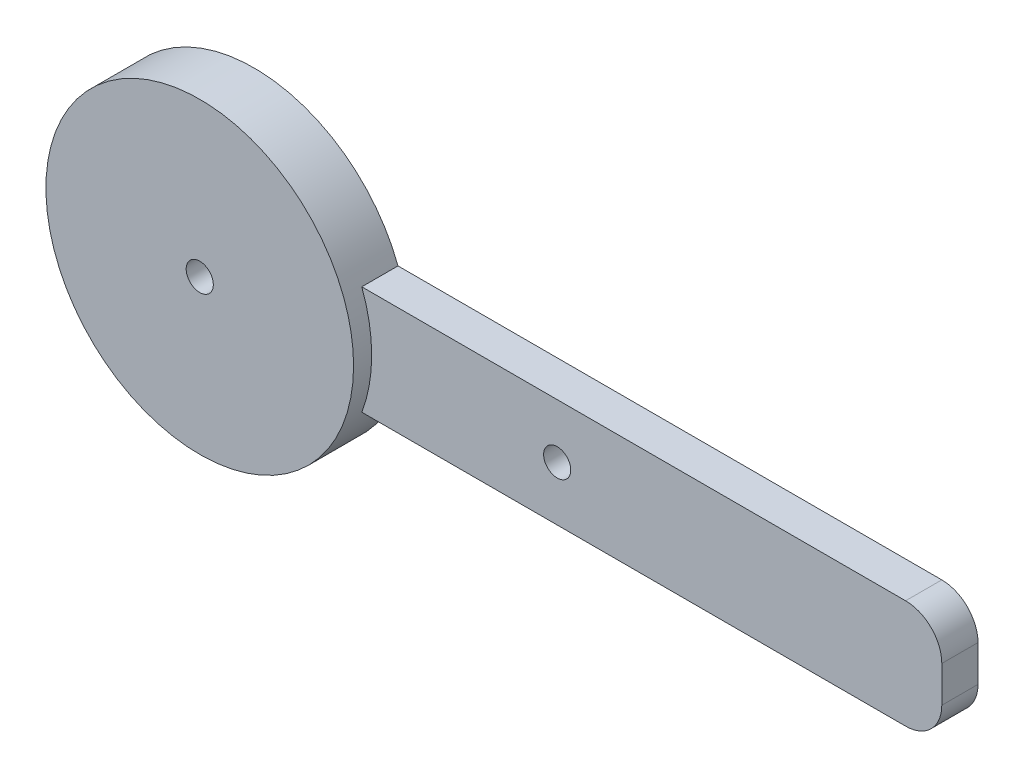
from build123d import *
from build123d.topology import SkipClean

# Parameters (mm, degrees)
SKETCH1_W                       = 80
SKETCH1_H                       = 12
BOSS_EXTRUDE1_DEPTH             = 2
CUT_REVOLVE1_ANGLE              = 180
FILLET2_R                       = 4
BOSS_EXTRUDE2_REACH             = 42.645
SKETCH6_R                       = 17
BOSS_EXTRUDE2_DIRECTION_2_DEPTH = 2
SKETCH7_R                       = 2.5
CUT_EXTRUDE3_DEPTH              = 3
CIRPATTERN1_COUNT               = 6
FILLET3_R                       = 1
CUT_EXTRUDE4_REACH              = 61.783
SKETCH8_R                       = 1.5
CUT_EXTRUDE5_REACH              = 61.783
SKETCH9_R                       = 1.5


with BuildPart() as part:
    # Sketch1 → Boss-Extrude1 (new, symmetric)
    with BuildSketch(Plane.XY):
        Rectangle(SKETCH1_W, SKETCH1_H)
    extrude(amount=BOSS_EXTRUDE1_DEPTH, both=True)

    # Sketch3 → Cut-Revolve1 (revolve, cut)
    with SkipClean():  # the faces are left unmerged after this step: merging them gives an invalid solid
        with BuildSketch(Plane.XY.offset(-2)):
            with BuildLine():
                ThreePointArc((37.75, 0), (35, 2.75), (32.25, 0))
                Line((32.25, 0), (37.75, 0))
            make_face()
            with BuildLine():
                Line((37.75, 0), (32.25, 0))
                ThreePointArc((32.25, 0), (35, -2.75), (37.75, 0))
            make_face()
        revolve(axis=Axis((32.25, 0, -2), (1, 0, 0)), revolution_arc=CUT_REVOLVE1_ANGLE, mode=Mode.SUBTRACT)

    # Fillet2
    fillet2_edges = [part.edges().sort_by_distance(p)[0] for p in [
        (40, -6, 0),
        (40, 6, 0),
    ]]
    fillet(fillet2_edges, radius=FILLET2_R)

    # Boss-Extrude2: up to this face of the body (flat: up to its plane)
    boss_extrude2_end = Plane(part.part.faces().sort_by_distance((-1.183693998, 0, -2))[0])
    # Sketch6 → Boss-Extrude2 (add, up to the picked face)
    with BuildSketch(Plane.XY.offset(2), mode=Mode.PRIVATE) as boss_extrude2_sk1:
        with Locations(Location((-40, 0, 0), (0, 0, 20.667316494))):
            Circle(SKETCH6_R)
    boss_extrude2_tool1 = split(extrude(boss_extrude2_sk1.sketch, amount=-BOSS_EXTRUDE2_REACH, mode=Mode.PRIVATE), bisect_by=boss_extrude2_end, keep=Keep.BOTH, mode=Mode.PRIVATE)
    add(boss_extrude2_tool1.solids().sort_by(Axis((-40, 0, 2), (0, 0, -1)))[0])

    # Sketch6 → Boss-Extrude2 direction 2 (add)
    with BuildSketch(Plane.XY.offset(2)):
        with Locations(Location((-40, 0, 0), (0, 0, 20.667316494))):
            Circle(SKETCH6_R)
    extrude(amount=BOSS_EXTRUDE2_DIRECTION_2_DEPTH)

    # Sketch7 → Cut-Extrude3 (cut)
    with BuildSketch(Plane(origin=(0, 0, -2), x_dir=(-1, 0, 0), z_dir=(0, 0, -1))):
        with BuildLine():
            Line((41.148365434, 4.169758006), (40, 4.325))
            ThreePointArc((40, 4.325), (35.675, 0), (40, -4.325))
            Line((40, -4.325), (41.148365434, -4.169758006))
            ThreePointArc((41.148365434, -4.169758006), (43.440371019, -2.620967808), (44.325, 0))
            ThreePointArc((44.325, 0), (43.440371019, 2.620967808), (41.148365434, 4.169758006))
        make_face()
        with BuildLine():
            Line((53.5, 2.5), (41.148365434, 4.169758006))
            ThreePointArc((41.148365434, 4.169758006), (43.440371019, 2.620967808), (44.325, 0))
            ThreePointArc((44.325, 0), (43.440371019, -2.620967808), (41.148365434, -4.169758006))
            Line((41.148365434, -4.169758006), (53.5, -2.5))
            ThreePointArc((53.5, -2.5), (51, 0), (53.5, 2.5))
        make_face()
        with Locations((53.5, 0)):
            Circle(SKETCH7_R)
    cut_extrude3 = extrude(amount=-CUT_EXTRUDE3_DEPTH, mode=Mode.SUBTRACT)

    # CirPattern1: Cut-Extrude3 ×6 about axis
    cirpattern1_axis = Axis((-40, 0, 0), (0, 0, 1))
    for i in range(1, CIRPATTERN1_COUNT):
        add(cut_extrude3.rotate(cirpattern1_axis, i * 360 / CIRPATTERN1_COUNT), mode=Mode.SUBTRACT)

    # Fillet3
    fillet3_edges = [part.edges().sort_by_distance(p)[0] for p in [
        (-46.069873399, 3.504443041, -0.5),
        (-40, 7.008886081, -0.5),
        (-33.930126601, 3.504443041, -0.5),
        (-33.930126601, -3.504443041, -0.5),
        (-40, -7.008886081, -0.5),
        (-46.069873399, -3.504443041, -0.5),
    ]]
    fillet(fillet3_edges, radius=FILLET3_R)

    # Sketch8 → Cut-Extrude4 (cut, up to next)
    with BuildSketch(Plane.XY.offset(4), mode=Mode.PRIVATE) as cut_extrude4_sk1:
        with Locations((-40, 0)):
            Circle(SKETCH8_R)
    cut_extrude4_tool1 = extrude(cut_extrude4_sk1.sketch, amount=-CUT_EXTRUDE4_REACH, mode=Mode.PRIVATE) & part.part
    add(cut_extrude4_tool1.solids().sort_by_distance((-40, 0, 4))[0], mode=Mode.SUBTRACT)

    # Sketch9 → Cut-Extrude5 (cut, up to next)
    with BuildSketch(Plane(origin=(0, 0, -2), x_dir=(-1, 0, 0), z_dir=(0, 0, -1)), mode=Mode.PRIVATE) as cut_extrude5_sk1:
        with Locations((2.5, 0)):
            Circle(SKETCH9_R)
    cut_extrude5_tool1 = extrude(cut_extrude5_sk1.sketch, amount=-CUT_EXTRUDE5_REACH, mode=Mode.PRIVATE) & part.part
    add(cut_extrude5_tool1.solids().sort_by_distance((-2.5, 0, -2))[0], mode=Mode.SUBTRACT)


solid = part.part
